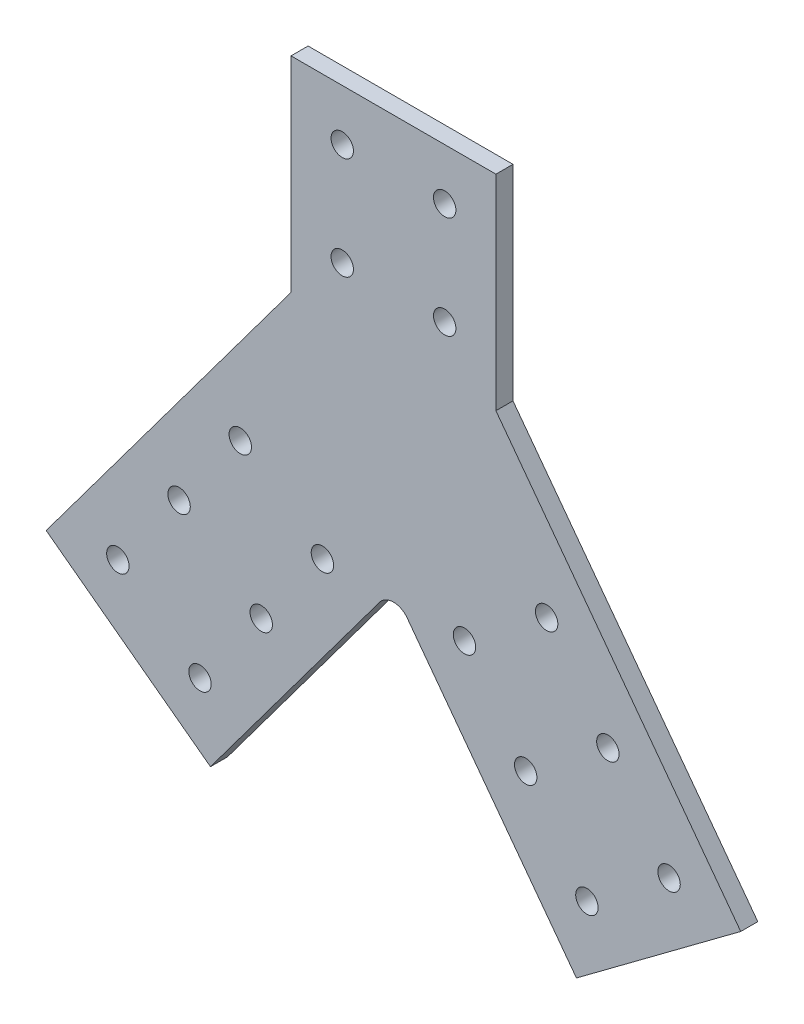
from build123d import *

# Parameters (mm, degrees)
BOSS_EXTRUDE1_DEPTH              = 6.35
F_21_64_0_32813_DIAMETER_HOLE1_D = 8.334502
LPATTERN1_COUNT                  = 2
LPATTERN1_PITCH                  = 38.1
LPATTERN1_COUNT_DIR2             = 2
LPATTERN1_PITCH_DIR2             = 38.1
F_21_64_0_32813_DIAMETER_HOLE2_D = 8.334502
LPATTERN2_COUNT                  = 2
LPATTERN2_PITCH                  = 38.1
LPATTERN2_COUNT_DIR2             = 3
LPATTERN2_PITCH_DIR2             = 38.1
F_21_64_0_32813_DIAMETER_HOLE3_D = 8.334502
LPATTERN3_COUNT                  = 2
LPATTERN3_PITCH                  = 38.1
LPATTERN3_COUNT_DIR2             = 3
LPATTERN3_PITCH_DIR2             = 38.1
FILLET1_R                        = 6.35


with BuildPart() as part:
    # Sketch1 → Boss-Extrude1 (new body)
    with BuildSketch(Plane.XY):
        Polygon((0, 0), (76.2, 0), (76.2, -76.2), (167.256744728, -198.406502444), (106.153493506, -243.934874808), (38.1, -152.600845184), (-29.953493506, -243.934874808), (-91.056744728, -198.406502444), (0, -76.2), align=None)
    extrude(amount=BOSS_EXTRUDE1_DEPTH)

    # 21/64 (0.32813) Diameter Hole1 (through all)
    with Locations(Plane.XY.offset(6.35)):
        with Locations((57.15, -19.05)):
            f_21_64_0_32813_diameter_hole1 = Hole(F_21_64_0_32813_DIAMETER_HOLE1_D / 2)

    # LPattern1: 21_64 _0.32813_ Diameter Hole1 2 × 2
    with Locations(*[(-i * LPATTERN1_PITCH, -j * LPATTERN1_PITCH_DIR2, 0) for i in range(LPATTERN1_COUNT) for j in range(LPATTERN1_COUNT_DIR2) if (i, j) != (0, 0)]):
        add(f_21_64_0_32813_diameter_hole1, mode=Mode.SUBTRACT)

    # 21/64 (0.32813) Diameter Hole2 (through all)
    with Locations(Plane.XY.offset(6.35)):
        with Locations((-64.398838831, -194.512782729)):
            f_21_64_0_32813_diameter_hole2 = Hole(F_21_64_0_32813_DIAMETER_HOLE2_D / 2)

    # LPattern2: 21_64 _0.32813_ Diameter Hole2 2 × 3
    with Locations(*[Vector(0.8018799372965569, -0.5974852016253374, 0) * (i * LPATTERN2_PITCH) + Vector(0.5974852016253378, 0.8018799372965567, 0) * (j * LPATTERN2_PITCH_DIR2) for i in range(LPATTERN2_COUNT) for j in range(LPATTERN2_COUNT_DIR2) if (i, j) != (0, 0)]):
        add(f_21_64_0_32813_diameter_hole2, mode=Mode.SUBTRACT)

    # 21/64 (0.32813) Diameter Hole3 (through all)
    with Locations(Plane.XY.offset(6.35)):
        with Locations((140.598838831, -194.512782729)):
            f_21_64_0_32813_diameter_hole3 = Hole(F_21_64_0_32813_DIAMETER_HOLE3_D / 2)

    # LPattern3: 21_64 _0.32813_ Diameter Hole3 2 × 3
    with Locations(*[Vector(-0.8018799372965564, -0.597485201625338, 0) * (i * LPATTERN3_PITCH) + Vector(-0.5974852016253386, 0.8018799372965559, 0) * (j * LPATTERN3_PITCH_DIR2) for i in range(LPATTERN3_COUNT) for j in range(LPATTERN3_COUNT_DIR2) if (i, j) != (0, 0)]):
        add(f_21_64_0_32813_diameter_hole3, mode=Mode.SUBTRACT)

    # Fillet1
    fillet1_edges = [part.edges().sort_by_distance(p)[0] for p in [
        (38.1, -152.600845184, 3.175),
    ]]
    fillet(fillet1_edges, radius=FILLET1_R)


solid = part.part
